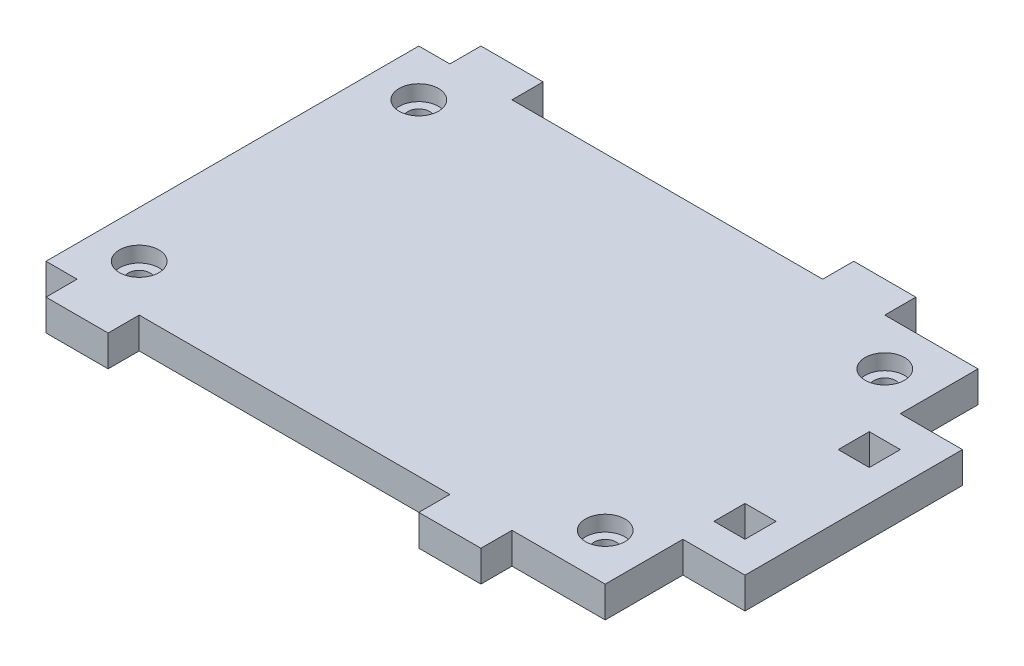
from build123d import *

# Parameters (mm, degrees)
SKETCH1_R           = 1.75
SKETCH1_W           = 5
SKETCH1_H           = 5
BOSS_EXTRUDE1_DEPTH = 5
SKETCH2_R           = 3.175
CUT_EXTRUDE1_DEPTH  = 2.5


with BuildPart() as part:
    # Sketch1 → Boss-Extrude1 (new body)
    with BuildSketch(Plane(origin=(0, 0, 0), x_dir=(1, 0, 0), z_dir=(0, 1, 0))):
        Polygon((30, 30), (45, 30), (45, 17.5), (55, 17.5), (55, -17.5), (45, -17.5), (45, -30), (30, -30), (30, -35), (20, -35), (20, -30), (-30, -30), (-30, -35), (-40, -35), (-40, -30), (-45, -30), (-45, 30), (-40, 30), (-40, 35), (-30, 35), (-30, 30), (20, 30), (20, 35), (30, 35), align=None)
        with Locations(Location((37.5, 22.5, 0), (0, 0, 270))):
            Circle(SKETCH1_R, mode=Mode.SUBTRACT)
        with Locations(Location((37.5, -22.5, 0), (0, 0, 270))):
            Circle(SKETCH1_R, mode=Mode.SUBTRACT)
        with Locations(Location((-37.5, 22.5, 0), (0, 0, 270))):
            Circle(SKETCH1_R, mode=Mode.SUBTRACT)
        with Locations(Location((-37.5, -22.5, 0), (0, 0, 270))):
            Circle(SKETCH1_R, mode=Mode.SUBTRACT)
        with Locations((47.5, 10)):
            Rectangle(SKETCH1_W, SKETCH1_H, mode=Mode.SUBTRACT)
        with Locations((47.5, -10)):
            Rectangle(SKETCH1_W, SKETCH1_H, mode=Mode.SUBTRACT)
    extrude(amount=BOSS_EXTRUDE1_DEPTH)

    # Sketch2 → Cut-Extrude1 (cut)
    with BuildSketch(Plane(origin=(0, 5, 0), x_dir=(1, 0, 0), z_dir=(0, 1, 0))):
        with Locations(Location((-37.5, 22.5, 0), (0, 0, 270))):
            Circle(SKETCH2_R)
        with Locations(Location((-37.5, -22.5, 0), (0, 0, 270))):
            Circle(SKETCH2_R)
        with Locations(Location((37.5, 22.5, 0), (0, 0, 270))):
            Circle(SKETCH2_R)
        with Locations(Location((37.5, -22.5, 0), (0, 0, 270))):
            Circle(SKETCH2_R)
    extrude(amount=-CUT_EXTRUDE1_DEPTH, mode=Mode.SUBTRACT)


solid = part.part
